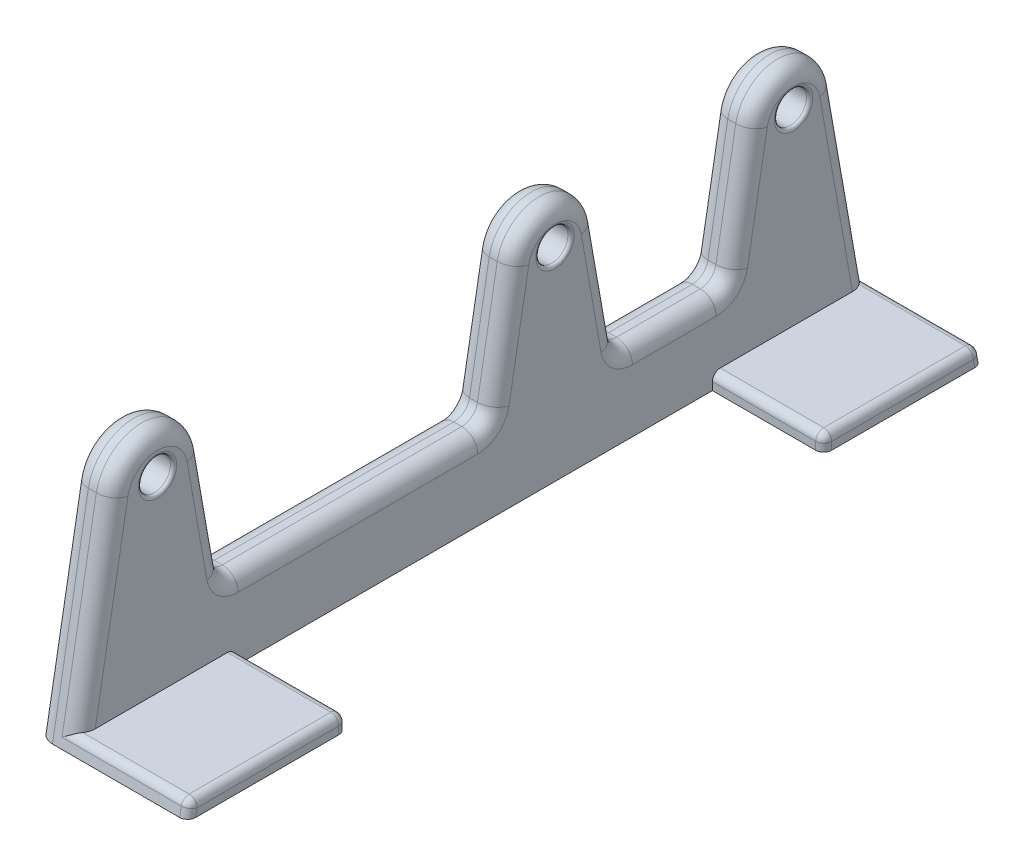
from build123d import *

# Parameters (mm, degrees)
BASEEXTRUDE_DEPTH        = 25
BASEWHLESSKETCH_R        = 10.099999999999994
BASEWHLESSKETCH_R_2      = 10.099999999999975
WHOLESCUT_DEPTH          = 25
BOSS_EXTRUDE1_DEPTH      = 70
BOSS_EXTRUDE1_DEPTH_BACK = 10
CUT_EXTRUDE1_DEPTH       = 70
FILLET3_R                = 10
FILLET4_R                = 5
FILLET5_R                = 2
SCALE1_SCALE             = 0.5


with BuildPart() as part:
    # BaseSketch → BaseExtrude (new body)
    with BuildSketch(Plane(origin=(0, 0, 0), x_dir=(0, 0, -1), z_dir=(1, 0, 0))):
        with BuildLine():
            Line((341.3175911166535, 49.240387650610245), (327.4257369032995, 128.02500789158682))
            ThreePointArc((327.4257369032995, 128.02500789158682), (301.05152041044613, 150.1556032233296), (274.6773039175927, 128.02500789158682))
            Line((274.6773039175927, 128.02500789158682), (260.7854497042379, 49.240387650610245))
            Line((260.7854497042379, 49.240387650610245), (93.4206319375457, 49.24038765061042))
            Line((93.4206319375457, 49.24038765061042), (79.52877772419151, 128.0250078915871))
            ThreePointArc((79.52877772419151, 128.0250078915871), (51.05152041044603, 151.9202640004915), (22.574263096700555, 128.0250078915871))
            Line((22.574263096700555, 128.0250078915871), (0, 0))
            Line((0, 0), (500, 0))
            Line((500, 0), (477.42573690329937, 128.0250078915871))
            ThreePointArc((477.42573690329937, 128.0250078915871), (451.051520410446, 150.15560322333013), (424.6773039175926, 128.0250078915871))
            Line((424.6773039175926, 128.0250078915871), (410.78544970423786, 49.24038765061051))
            Line((410.78544970423786, 49.24038765061051), (341.3175911166535, 49.240387650610245))
        make_face()
    extrude(amount=-BASEEXTRUDE_DEPTH)

    # Basewhlessketch → WholesCut (cut)
    with BuildSketch(Plane(origin=(0, 0, 0), x_dir=(0, 0, -1), z_dir=(1, 0, 0))):
        with Locations((51.05152041044603, 128.0250078915871)):
            Circle(BASEWHLESSKETCH_R)
        with Locations((301.05152041044613, 128.0250078915871)):
            Circle(BASEWHLESSKETCH_R_2)
        with Locations((451.051520410446, 128.0250078915871)):
            Circle(BASEWHLESSKETCH_R_2)
    extrude(amount=-WHOLESCUT_DEPTH, mode=Mode.SUBTRACT)

    # Sketch1 → Boss-Extrude1 (add, two sides: drawn at the far end of the back side and taken through both)
    with BuildSketch(Plane(origin=(0, 0, 0), x_dir=(0, 0, -1), z_dir=(1, 0, 0)).offset(-BOSS_EXTRUDE1_DEPTH_BACK)):
        Polygon((0, 0), (500, 0), (498.2635182233307, 9.848077530122145), (1.736481776669274, 9.848077530122085), align=None)
    extrude(amount=BOSS_EXTRUDE1_DEPTH + BOSS_EXTRUDE1_DEPTH_BACK)

    # Sketch2 → Cut-Extrude1 (cut)
    with BuildSketch(Plane(origin=(70, 0, 0), x_dir=(0, 0, -1), z_dir=(1, 0, 0))):
        Polygon((100, 0), (400, -1.225e-14), (400, 9.848077530122138), (100, 9.848077530122138), align=None)
    extrude(amount=-CUT_EXTRUDE1_DEPTH, mode=Mode.SUBTRACT)

    # Fillet3
    fillet3_edges = [part.edges().sort_by_distance(p)[0] for p in [
        (-25, 150.1556032233296, -301.05152041044613),
        (0, 49.24038765061037, -376.0515204104457),
        (0, 88.6326977710988, -417.73137681091526),
        (0, 150.15560322333013, -451.051520410446),
        (0, 68.93654271085462, -487.84462756331504),
        (-25, 88.63269777109853, -267.7313768109153),
        (0, 151.9202640004915, -51.05152041044603),
        (0, 88.63269777109878, -86.4747048308686),
        (0, 49.24038765061033, -177.1030408208918),
        (0, 88.63269777109853, -267.7313768109153),
        (0, 150.1556032233296, -301.05152041044613),
        (0, 88.63269777109853, -334.3716640099765),
        (-25, 49.24038765061033, -177.1030408208918),
        (-12.5, 49.240387650610245, -341.3175911166535),
        (-12.5, 49.24038765061051, -410.78544970423786),
        (-12.5, 49.24038765061042, -93.4206319375457),
        (-12.5, 49.240387650610245, -260.7854497042379),
        (-25, 88.63269777109878, -86.4747048308686),
        (-25, 151.9202640004915, -51.05152041044603),
        (-25, 64.01250394579355, -11.287131548350278),
        (-25, 64.01250394579355, -488.7128684516497),
        (-25, 150.15560322333013, -451.051520410446),
        (0, 68.93654271085461, -12.155372436684916),
        (-25, 88.6326977710988, -417.73137681091526),
        (-25, 88.63269777109853, -334.3716640099765),
        (-25, 49.24038765061037, -376.0515204104457),
    ]]
    fillet(fillet3_edges, radius=FILLET3_R)

    # Fillet4
    fillet4_edges = [part.edges().sort_by_distance(p)[0] for p in [
        (70, 9.84807753012209, -50.86824088833464),
        (30, 9.848077530122083, -1.736481776669275),
        (35, 9.848077530122138, -100),
        (70, 4.924038765061042, -0.868240888334637),
        (70, 4.924038765061069, -100),
        (30, 9.848077530122145, -498.2635182233307),
        (70, 9.84807753012214, -449.13175911166536),
        (35, 9.848077530122138, -400),
        (70, 4.924038765061063, -400),
        (70, 4.924038765061073, -499.13175911166536),
    ]]
    fillet(fillet4_edges, radius=FILLET4_R)

    # Fillet5
    fillet5_edges = [part.edges().sort_by_distance(p)[0] for p in [
        (-25, 128.0250078915871, -40.95152041044604),
        (0, 128.0250078915871, -40.95152041044604),
        (-25, 128.0250078915871, -290.95152041044616),
        (0, 128.0250078915871, -290.95152041044616),
        (-25, 128.0250078915871, -440.95152041044605),
        (0, 128.0250078915871, -440.95152041044605),
    ]]
    fillet(fillet5_edges, radius=FILLET5_R)


with BuildPart() as part_1:
    # Scale1: scaled about (0, 0, 0)
    add(part.part.scale(SCALE1_SCALE))


solid = part_1.part
